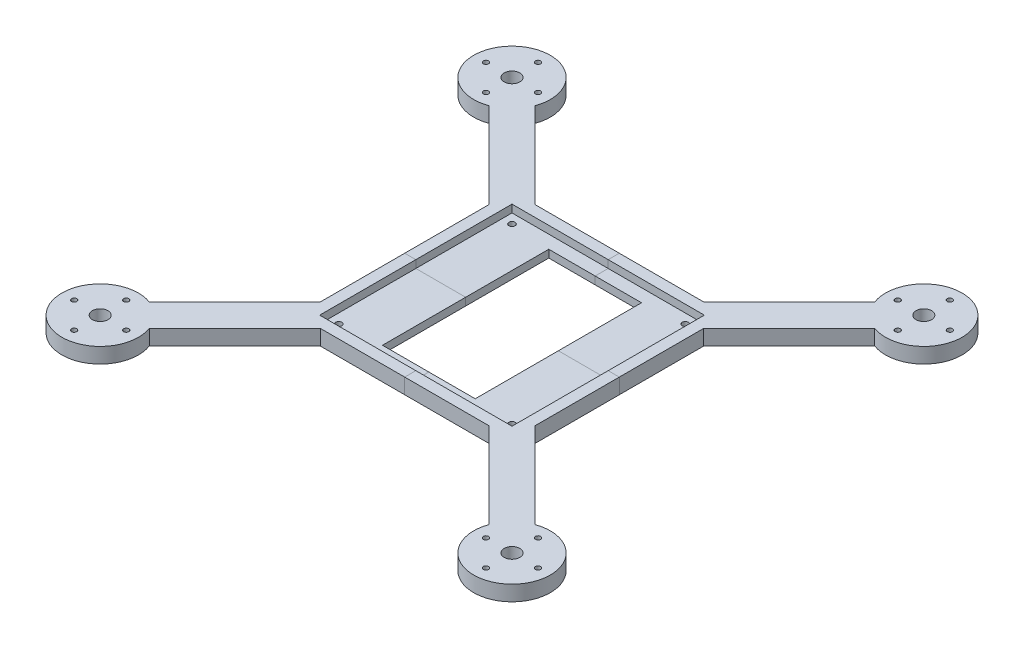
from build123d import *

# Parameters (mm, degrees)
SKETCH_1_R                       = 2
SKETCH_1_R_2                     = 1.7
SKETCH_1_R_3                     = 5.1
SKETCH_1_W                       = 60.5
SKETCH_1_H                       = 108.5
EXTRUDE_1_DEPTH                  = 10
SKETCH_4_W                       = 125.5
SKETCH_4_H                       = 125.5
CUT_EXTRUDE_1_DEPTH              = 5
SPLIT_BODIES_2_SURFACE_1_1_BACK  = 451.822
SPLIT_BODIES_2_SURFACE_1_1_DEPTH = 903.644
SPLIT_BODIES_2_SURFACE_1_2_BACK  = 451.822
SPLIT_BODIES_2_SURFACE_1_2_DEPTH = 903.644
SPLIT_BODIES_2_SURFACE_2_3_BACK  = 451.822
SPLIT_BODIES_2_SURFACE_2_3_DEPTH = 903.644
SPLIT_BODIES_2_SURFACE_2_4_BACK  = 451.822
SPLIT_BODIES_2_SURFACE_2_4_DEPTH = 903.644
SPLIT_BODIES_2_SURFACE_2_5_BACK  = 451.822
SPLIT_BODIES_2_SURFACE_2_5_DEPTH = 903.644
SPLIT_BODIES_2_SURFACE_2_6_BACK  = 451.822
SPLIT_BODIES_2_SURFACE_2_6_DEPTH = 903.644


with BuildPart() as part:
    # 스케치1 → 보스-돌출1 (new body)
    with BuildSketch(Plane(origin=(0, 0, 0), x_dir=(1, 0, 0), z_dir=(0, 1, 0))):
        with BuildLine():
            Line((55, 70), (110.842477832, 125.842477832))
            ThreePointArc((110.842477832, 125.842477832), (152.027957955, 152.027957955), (125.842477832, 110.842477832))
            Line((125.842477832, 110.842477832), (70, 55))
            Line((70, 55), (70, -55))
            Line((70, -55), (125.842477832, -110.842477832))
            ThreePointArc((125.842477832, -110.842477832), (152.027957955, -152.027957955), (110.842477832, -125.842477832))
            Line((110.842477832, -125.842477832), (55, -70))
            Line((55, -70), (-55, -70))
            Line((-55, -70), (-110.842477832, -125.842477832))
            ThreePointArc((-110.842477832, -125.842477832), (-152.027957955, -152.027957955), (-125.842477832, -110.842477832))
            Line((-125.842477832, -110.842477832), (-70, -55))
            Line((-70, -55), (-70, 55))
            Line((-70, 55), (-125.842477832, 110.842477832))
            ThreePointArc((-125.842477832, 110.842477832), (-152.027957955, 152.027957955), (-110.842477832, 125.842477832))
            Line((-110.842477832, 125.842477832), (-55, 70))
            Line((-55, 70), (55, 70))
        make_face()
        with Locations((-56.5, -56.5)):
            Circle(SKETCH_1_R, mode=Mode.SUBTRACT)
        with Locations((56.5, -56.5)):
            Circle(SKETCH_1_R, mode=Mode.SUBTRACT)
        with Locations((56.5, 56.5)):
            Circle(SKETCH_1_R, mode=Mode.SUBTRACT)
        with Locations((-56.5, 56.5)):
            Circle(SKETCH_1_R, mode=Mode.SUBTRACT)
        with Locations((134.350288425, 117.350288425)):
            Circle(SKETCH_1_R_2, mode=Mode.SUBTRACT)
        with Locations((117.350288425, 134.350288425)):
            Circle(SKETCH_1_R_2, mode=Mode.SUBTRACT)
        with Locations((151.350288425, 134.350288425)):
            Circle(SKETCH_1_R_2, mode=Mode.SUBTRACT)
        with Locations((134.350288425, 151.350288425)):
            Circle(SKETCH_1_R_2, mode=Mode.SUBTRACT)
        with Locations((134.350288425, 134.350288425)):
            Circle(SKETCH_1_R_3, mode=Mode.SUBTRACT)
        with Locations((117.350288425, -134.350288425)):
            Circle(SKETCH_1_R_2, mode=Mode.SUBTRACT)
        with Locations((134.350288425, -117.350288425)):
            Circle(SKETCH_1_R_2, mode=Mode.SUBTRACT)
        with Locations((134.350288425, -151.350288425)):
            Circle(SKETCH_1_R_2, mode=Mode.SUBTRACT)
        with Locations((151.350288425, -134.350288425)):
            Circle(SKETCH_1_R_2, mode=Mode.SUBTRACT)
        with Locations((134.350288425, -134.350288425)):
            Circle(SKETCH_1_R_3, mode=Mode.SUBTRACT)
        with Locations((-134.350288425, -117.350288425)):
            Circle(SKETCH_1_R_2, mode=Mode.SUBTRACT)
        with Locations((-117.350288425, -134.350288425)):
            Circle(SKETCH_1_R_2, mode=Mode.SUBTRACT)
        with Locations((-151.350288425, -134.350288425)):
            Circle(SKETCH_1_R_2, mode=Mode.SUBTRACT)
        with Locations((-134.350288425, -151.350288425)):
            Circle(SKETCH_1_R_2, mode=Mode.SUBTRACT)
        with Locations((-134.350288425, -134.350288425)):
            Circle(SKETCH_1_R_3, mode=Mode.SUBTRACT)
        with Locations((-117.350288425, 134.350288425)):
            Circle(SKETCH_1_R_2, mode=Mode.SUBTRACT)
        with Locations((-134.350288425, 117.350288425)):
            Circle(SKETCH_1_R_2, mode=Mode.SUBTRACT)
        with Locations((-134.350288425, 151.350288425)):
            Circle(SKETCH_1_R_2, mode=Mode.SUBTRACT)
        with Locations((-151.350288425, 134.350288425)):
            Circle(SKETCH_1_R_2, mode=Mode.SUBTRACT)
        with Locations((-134.350288425, 134.350288425)):
            Circle(SKETCH_1_R_3, mode=Mode.SUBTRACT)
        Rectangle(SKETCH_1_W, SKETCH_1_H, mode=Mode.SUBTRACT)
    extrude(amount=-EXTRUDE_1_DEPTH)

    # 스케치4 → 컷-돌출1 (cut)
    with BuildSketch(Plane(origin=(0, 0, 0), x_dir=(1, 0, 0), z_dir=(0, 1, 0))):
        Rectangle(SKETCH_4_W, SKETCH_4_H)
    extrude(amount=-CUT_EXTRUDE_1_DEPTH, mode=Mode.SUBTRACT)


with BuildPart() as body_2:
    # Split Bodies 2: the piece behind the surface
    add(part.part)
    # Split Bodies 2 surface 1: a surface, the sketch's curves swept straight by 903.644 mm
    with BuildLine(Plane(origin=(0, 0, 0), x_dir=(1, 0, 0), z_dir=(0, 1, 0)).offset(-SPLIT_BODIES_2_SURFACE_1_1_BACK), mode=Mode.PRIVATE) as split_bodies_2_surface_1_1_path:
        Line((0, 70), (0, -70))
    split_bodies_2_surface_1_1 = Shell.extrude(split_bodies_2_surface_1_1_path.wire(), (0 * SPLIT_BODIES_2_SURFACE_1_1_DEPTH, 1 * SPLIT_BODIES_2_SURFACE_1_1_DEPTH, 0 * SPLIT_BODIES_2_SURFACE_1_1_DEPTH))
    split(bisect_by=split_bodies_2_surface_1_1, keep=Keep.BOTTOM)


with BuildPart() as part_1:
    add(part.part)

    # Split Bodies 2: split by a surface, the side it looks to stays
    # Split Bodies 2 surface 1: a surface, the sketch's curves swept straight by 903.644 mm
    with BuildLine(Plane(origin=(0, 0, 0), x_dir=(1, 0, 0), z_dir=(0, 1, 0)).offset(-SPLIT_BODIES_2_SURFACE_1_2_BACK), mode=Mode.PRIVATE) as split_bodies_2_surface_1_2_path:
        Line((0, 70), (0, -70))
    split_bodies_2_surface_1_2 = Shell.extrude(split_bodies_2_surface_1_2_path.wire(), (0 * SPLIT_BODIES_2_SURFACE_1_2_DEPTH, 1 * SPLIT_BODIES_2_SURFACE_1_2_DEPTH, 0 * SPLIT_BODIES_2_SURFACE_1_2_DEPTH))
    split(bisect_by=split_bodies_2_surface_1_2, keep=Keep.TOP)


with BuildPart() as body_3:
    # Split Bodies 2 2: the piece behind the surface
    add(part_1.part)
    # Split Bodies 2 surface 2: a surface, the sketch's curves swept straight by 903.644 mm
    with BuildLine(Plane(origin=(0, 0, 0), x_dir=(1, 0, 0), z_dir=(0, 1, 0)).offset(-SPLIT_BODIES_2_SURFACE_2_3_BACK), mode=Mode.PRIVATE) as split_bodies_2_surface_2_3_path:
        Line((-70, 0), (70, 0))
    split_bodies_2_surface_2_3 = Shell.extrude(split_bodies_2_surface_2_3_path.wire(), (0 * SPLIT_BODIES_2_SURFACE_2_3_DEPTH, 1 * SPLIT_BODIES_2_SURFACE_2_3_DEPTH, 0 * SPLIT_BODIES_2_SURFACE_2_3_DEPTH))
    split(bisect_by=split_bodies_2_surface_2_3, keep=Keep.BOTTOM)


with BuildPart() as part_2:
    add(part_1.part)

    # Split Bodies 2 2: split by a surface, the side it looks to stays
    # Split Bodies 2 surface 2: a surface, the sketch's curves swept straight by 903.644 mm
    with BuildLine(Plane(origin=(0, 0, 0), x_dir=(1, 0, 0), z_dir=(0, 1, 0)).offset(-SPLIT_BODIES_2_SURFACE_2_4_BACK), mode=Mode.PRIVATE) as split_bodies_2_surface_2_4_path:
        Line((-70, 0), (70, 0))
    split_bodies_2_surface_2_4 = Shell.extrude(split_bodies_2_surface_2_4_path.wire(), (0 * SPLIT_BODIES_2_SURFACE_2_4_DEPTH, 1 * SPLIT_BODIES_2_SURFACE_2_4_DEPTH, 0 * SPLIT_BODIES_2_SURFACE_2_4_DEPTH))
    split(bisect_by=split_bodies_2_surface_2_4, keep=Keep.TOP)


with BuildPart() as body_4:
    # Split Bodies 2 2 body 2: the piece behind the surface
    add(body_2.part)
    # Split Bodies 2 surface 2: a surface, the sketch's curves swept straight by 903.644 mm
    with BuildLine(Plane(origin=(0, 0, 0), x_dir=(1, 0, 0), z_dir=(0, 1, 0)).offset(-SPLIT_BODIES_2_SURFACE_2_5_BACK), mode=Mode.PRIVATE) as split_bodies_2_surface_2_5_path:
        Line((-70, 0), (70, 0))
    split_bodies_2_surface_2_5 = Shell.extrude(split_bodies_2_surface_2_5_path.wire(), (0 * SPLIT_BODIES_2_SURFACE_2_5_DEPTH, 1 * SPLIT_BODIES_2_SURFACE_2_5_DEPTH, 0 * SPLIT_BODIES_2_SURFACE_2_5_DEPTH))
    split(bisect_by=split_bodies_2_surface_2_5, keep=Keep.BOTTOM)


with BuildPart() as body_2_1:
    add(body_2.part)

    # Split Bodies 2 2 body 2: split by a surface, the side it looks to stays
    # Split Bodies 2 surface 2: a surface, the sketch's curves swept straight by 903.644 mm
    with BuildLine(Plane(origin=(0, 0, 0), x_dir=(1, 0, 0), z_dir=(0, 1, 0)).offset(-SPLIT_BODIES_2_SURFACE_2_6_BACK), mode=Mode.PRIVATE) as split_bodies_2_surface_2_6_path:
        Line((-70, 0), (70, 0))
    split_bodies_2_surface_2_6 = Shell.extrude(split_bodies_2_surface_2_6_path.wire(), (0 * SPLIT_BODIES_2_SURFACE_2_6_DEPTH, 1 * SPLIT_BODIES_2_SURFACE_2_6_DEPTH, 0 * SPLIT_BODIES_2_SURFACE_2_6_DEPTH))
    split(bisect_by=split_bodies_2_surface_2_6, keep=Keep.TOP)


solid = Compound([body_3.part, part_2.part, body_4.part, body_2_1.part])
